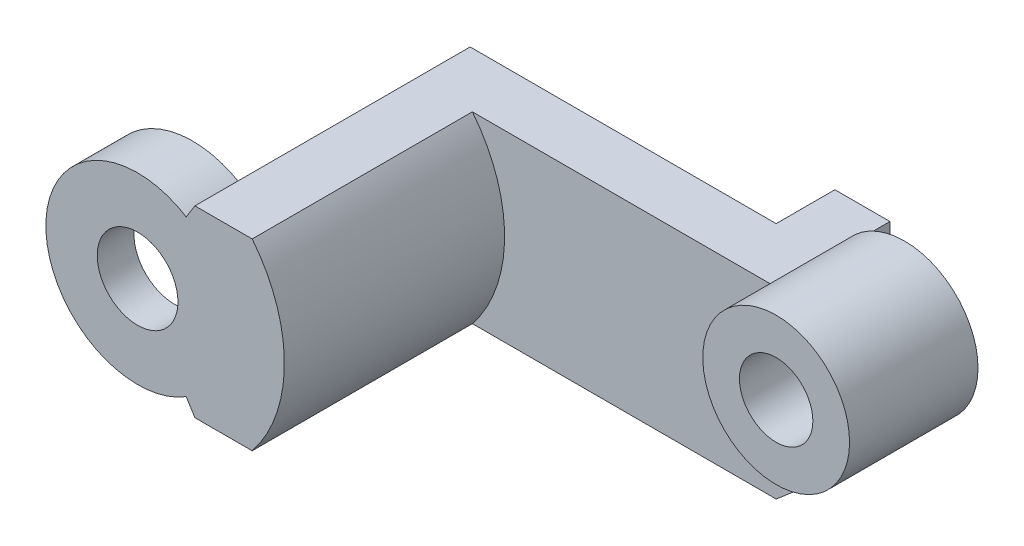
from build123d import *

# Parameters (mm, degrees)
SKETCH1_R           = 2.5
SKETCH1_R_2         = 1.1
BOSS_EXTRUDE1_DEPTH = 1
SKETCH2_R           = 2.5
SKETCH2_R_2         = 2.05
BOSS_EXTRUDE2_DEPTH = 0.5
BOSS_EXTRUDE4_DEPTH = 7.5
SKETCH5_R           = 1
BOSS_EXTRUDE5_DEPTH = 1.5
SKETCH6_W           = 1.5
SKETCH6_H           = 5
BOSS_EXTRUDE6_DEPTH = 1.6
SKETCH7_R           = 2
SKETCH7_R_2         = 1
BOSS_EXTRUDE7_DEPTH = 2


with BuildPart() as part:
    # Sketch1 → Boss-Extrude1 (new body)
    with BuildSketch(Plane.XY):
        Circle(SKETCH1_R)
        Circle(SKETCH1_R_2, mode=Mode.SUBTRACT)
    extrude(amount=-BOSS_EXTRUDE1_DEPTH)

    # Sketch2 → Boss-Extrude2 (add)
    with BuildSketch(Plane.XY.offset(-1)):
        Circle(SKETCH2_R)
        Circle(SKETCH2_R_2, mode=Mode.SUBTRACT)
    extrude(amount=-BOSS_EXTRUDE2_DEPTH)

    # Sketch3 → Boss-Extrude4 (add)
    with BuildSketch(Plane.XY):
        with BuildLine():
            Line((3.122498999, -2.5), (1.5612495, -2.5))
            Line((1.5612495, -2.5), (1.324234542, -2.120472324))
            ThreePointArc((1.324234542, -2.120472324), (2.5, 0), (1.324234542, 2.120472324))
            Line((1.324234542, 2.120472324), (1.5612495, 2.5))
            Line((1.5612495, 2.5), (3.122498999, 2.5))
            ThreePointArc((3.122498999, 2.5), (4, 0), (3.122498999, -2.5))
        make_face()
    extrude(amount=-BOSS_EXTRUDE4_DEPTH)

    # Sketch5 → Boss-Extrude5 (add)
    with BuildSketch(Plane(origin=(0, 0, -7.5), x_dir=(-1, 0, 0), z_dir=(0, 0, -1))):
        with BuildLine():
            Line((-3.122498999, -2.5), (-11.4, -2.5))
            Line((-11.4, -2.5), (-14.699339628, 0.319566992))
            ThreePointArc((-14.699339628, 0.319566992), (-14.529243579, 3.49069953), (-11.512038136, 2.5))
            Line((-11.512038136, 2.5), (-3.122498999, 2.5))
            Line((-3.122498999, 2.5), (-3.122498999, -2.5))
        make_face()
        with Locations((-13.4, 1.84)):
            Circle(SKETCH5_R, mode=Mode.SUBTRACT)
    extrude(amount=-BOSS_EXTRUDE5_DEPTH)

    # Sketch6 → Boss-Extrude6 (add)
    with BuildSketch(Plane(origin=(0, 0, -7.5), x_dir=(-1, 0, 0), z_dir=(0, 0, -1))):
        with Locations((-10.65, 0)):
            Rectangle(SKETCH6_W, SKETCH6_H)
    extrude(amount=BOSS_EXTRUDE6_DEPTH)

    # Sketch7 → Boss-Extrude7 (add)
    with BuildSketch(Plane.XY.offset(-6)):
        with Locations(Location((13.4, 1.84, 0), (0, 0, 160.731224509))):
            Circle(SKETCH7_R)
        with Locations(Location((13.4, 1.84, 0), (0, 0, 180))):
            Circle(SKETCH7_R_2, mode=Mode.SUBTRACT)
    extrude(amount=BOSS_EXTRUDE7_DEPTH)


solid = part.part
